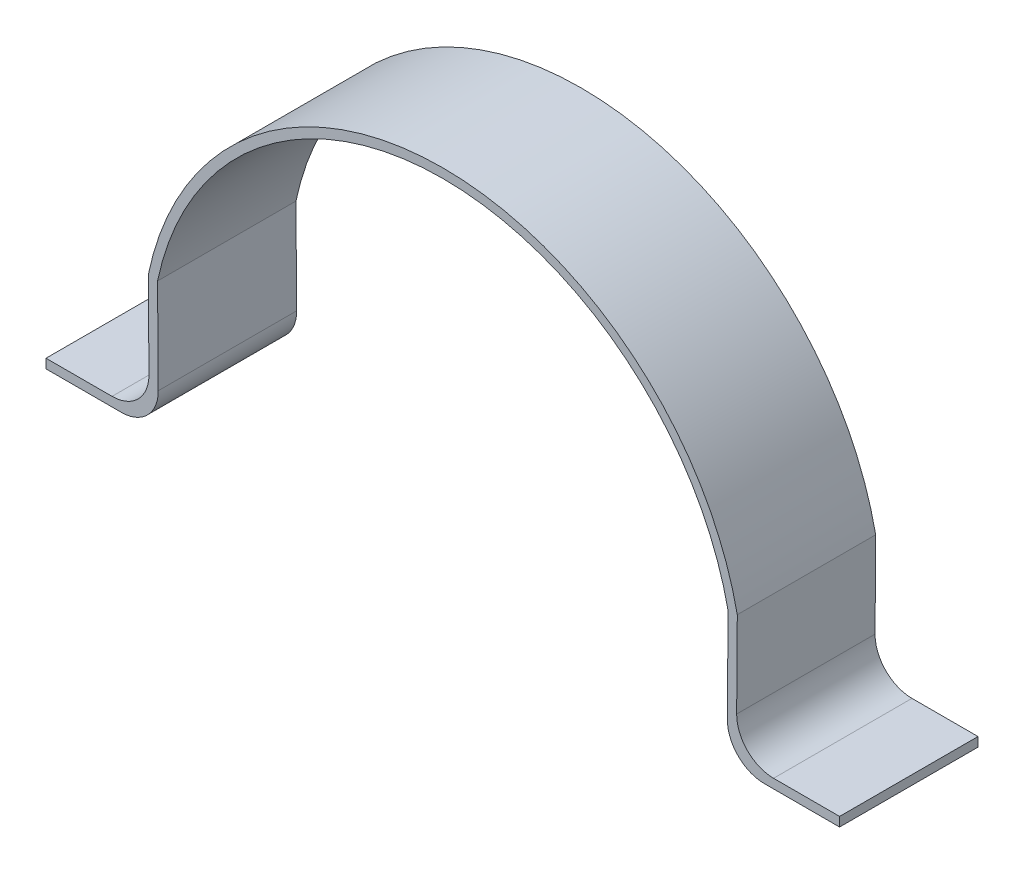
from build123d import *

# Parameters (mm, degrees)
EXTRUDE_1_DEPTH = 15
FILLET_1_R      = 4
FILLET_2_R      = 4
FILLET_3_R      = 4


with BuildPart() as part:
    # Эскиз8 → Вытянуть-Тонкостенный1 (new body)
    with BuildSketch(Plane.XY):
        with BuildLine():
            Line((43.007359098, -6.783419957), (31.819109934, -6.783419957))
            Line((31.819109934, -6.783419957), (31.9183647, 6.609638135))
            ThreePointArc((31.9183647, 6.609638135), (0, 32.595541435), (-31.9183647, 6.609638135))
            Line((-31.9183647, 6.609638135), (-31.819109934, -6.783419957))
            Line((-31.819109934, -6.783419957), (-43.007359098, -6.783419957))
            Line((-43.007359098, -6.783419957), (-43.007359098, -7.783419957))
            Line((-43.007359098, -7.783419957), (-30.811671563, -7.783419957))
            Line((-30.811671563, -7.783419957), (-30.917598952, 6.510016405))
            ThreePointArc((-30.917598952, 6.510016405), (0, 31.595541435), (30.917598952, 6.510016405))
            Line((30.917598952, 6.510016405), (30.811671563, -7.783419957))
            Line((30.811671563, -7.783419957), (43.007359098, -7.783419957))
            Line((43.007359098, -7.783419957), (43.007359098, -6.783419957))
        make_face()
    extrude(amount=EXTRUDE_1_DEPTH)

    # Скругление1
    fillet_1_edges = [part.edges().sort_by_distance(p)[0] for p in [
        (-31.819109934, -6.783419957, 7.5),
    ]]
    fillet(fillet_1_edges, radius=FILLET_1_R)

    # Скругление2
    fillet_2_edges = [part.edges().sort_by_distance(p)[0] for p in [
        (-30.811671563, -7.783419957, 7.5),
    ]]
    fillet(fillet_2_edges, radius=FILLET_2_R)

    # Скругление3
    fillet_3_edges = [part.edges().sort_by_distance(p)[0] for p in [
        (30.811671563, -7.783419957, 7.5),
        (31.819109934, -6.783419957, 7.5),
    ]]
    fillet(fillet_3_edges, radius=FILLET_3_R)


solid = part.part
